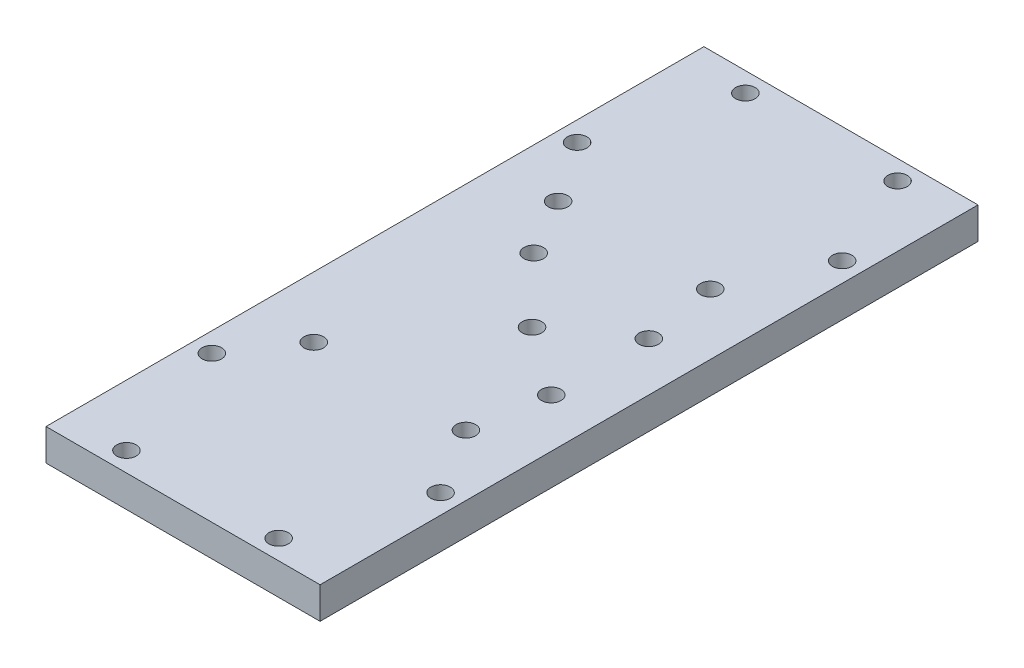
from build123d import *

# Parameters (mm, degrees)
SKETCH1_W                                = 56.2
SKETCH1_H                                = 134.9
SKETCH1_R                                = 2
BOSS_EXTRUDE1_DEPTH                      = 6.5
POLOLU_MOUNTING_BRACKET_R                = 2
POLOLU_37MM_MOUNTING_BRACKET_HOLES_DEPTH = 147.282945007
SKETCH2_R                                = 2
SPINDLE_MOUNT_DEPTH                      = 147.282945007


with BuildPart() as part:
    # Sketch1 → Boss-Extrude1 (new body)
    with BuildSketch(Plane(origin=(0, 0, 0), x_dir=(1, 0, 0), z_dir=(0, 1, 0))):
        with Locations((-28.1, 67.45)):
            Rectangle(SKETCH1_W, SKETCH1_H)
        with Locations(Location((-52.2, 104.9, 0), (0, 0, 90))):
            Circle(SKETCH1_R, mode=Mode.SUBTRACT)
        with Locations(Location((-4, 111.05, 0), (0, 0, 90))):
            Circle(SKETCH1_R, mode=Mode.SUBTRACT)
        with Locations(Location((-37, 80.8, 0), (0, 0, 90))):
            Circle(SKETCH1_R, mode=Mode.SUBTRACT)
        with Locations(Location((-52.2, 30, 0), (0, 0, 90))):
            Circle(SKETCH1_R, mode=Mode.SUBTRACT)
        with Locations(Location((-4, 28.7, 0), (0, 0, 90))):
            Circle(SKETCH1_R, mode=Mode.SUBTRACT)
    extrude(amount=BOSS_EXTRUDE1_DEPTH)

    # Pololu Mounting Bracket → Pololu 37mm mounting bracket holes (cut, through all)
    with BuildSketch(Plane(origin=(0, 6.5, 0), x_dir=(1, 0, 0), z_dir=(0, 1, 0))):
        with Locations(Location((-43.7, 4, 0), (0, 0, 270))):
            Circle(POLOLU_MOUNTING_BRACKET_R)
        with Locations(Location((-12.5, 4, 0), (0, 0, 270))):
            Circle(POLOLU_MOUNTING_BRACKET_R)
        with Locations(Location((-43.7, 42.4, 0), (0, 0, 270))):
            Circle(POLOLU_MOUNTING_BRACKET_R)
        with Locations(Location((-12.5, 42.4, 0), (0, 0, 270))):
            Circle(POLOLU_MOUNTING_BRACKET_R)
        with Locations(Location((-43.7, 130.9, 0), (0, 0, 270))):
            Circle(POLOLU_MOUNTING_BRACKET_R)
        with Locations(Location((-12.5, 130.9, 0), (0, 0, 270))):
            Circle(POLOLU_MOUNTING_BRACKET_R)
        with Locations(Location((-12.5, 92.5, 0), (0, 0, 270))):
            Circle(POLOLU_MOUNTING_BRACKET_R)
        with Locations(Location((-43.7, 92.5, 0), (0, 0, 270))):
            Circle(POLOLU_MOUNTING_BRACKET_R)
    extrude(amount=-POLOLU_37MM_MOUNTING_BRACKET_HOLES_DEPTH, mode=Mode.SUBTRACT)

    # Sketch2 → Spindle Mount (cut, through all)
    with BuildSketch(Plane.XZ):
        with Locations(Location((-24, -67.45, 0), (0, 0, 270))):
            Circle(SKETCH2_R)
        with Locations(Location((-10, -77.39530997, 0), (0, 0, 270))):
            Circle(SKETCH2_R)
        with Locations(Location((-10, -57.39530997, 0), (0, 0, 270))):
            Circle(SKETCH2_R)
    extrude(amount=-SPINDLE_MOUNT_DEPTH, mode=Mode.SUBTRACT)


solid = part.part
